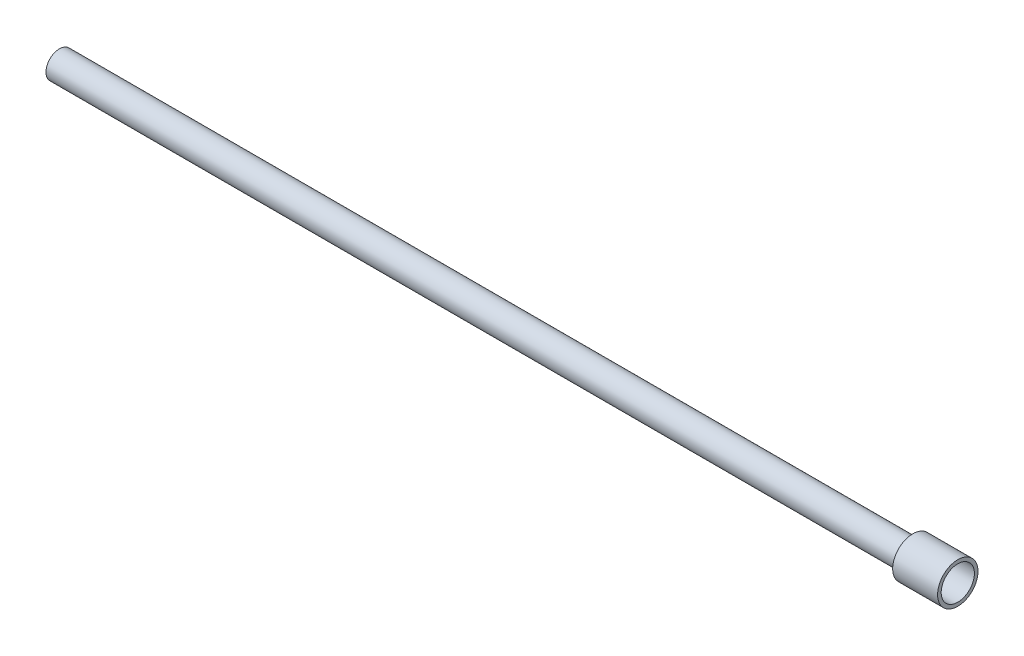
from build123d import *

# Parameters (mm, degrees)
SKETCH1_R           = 75
SKETCH1_R_2         = 37.5
BOSS_EXTRUDE1_DEPTH = 4750
SKETCH2_R           = 112.5
SKETCH2_R_2         = 92.5
BOSS_EXTRUDE2_DEPTH = 250


with BuildPart() as part:
    # Sketch1 → Boss-Extrude1 (new body)
    with BuildSketch(Plane(origin=(0, 0, 0), x_dir=(0, 0, -1), z_dir=(1, 0, 0))):
        Circle(SKETCH1_R)
        Circle(SKETCH1_R_2, mode=Mode.SUBTRACT)
    extrude(amount=BOSS_EXTRUDE1_DEPTH)


with BuildPart() as body_2:
    # Sketch2 → Boss-Extrude2 (new body)
    with BuildSketch(Plane(origin=(4750, 0, 0), x_dir=(0, 0, -1), z_dir=(1, 0, 0))):
        Circle(SKETCH2_R)
        Circle(SKETCH2_R_2, mode=Mode.SUBTRACT)
    extrude(amount=BOSS_EXTRUDE2_DEPTH)


solid = Compound([part.part, body_2.part])
